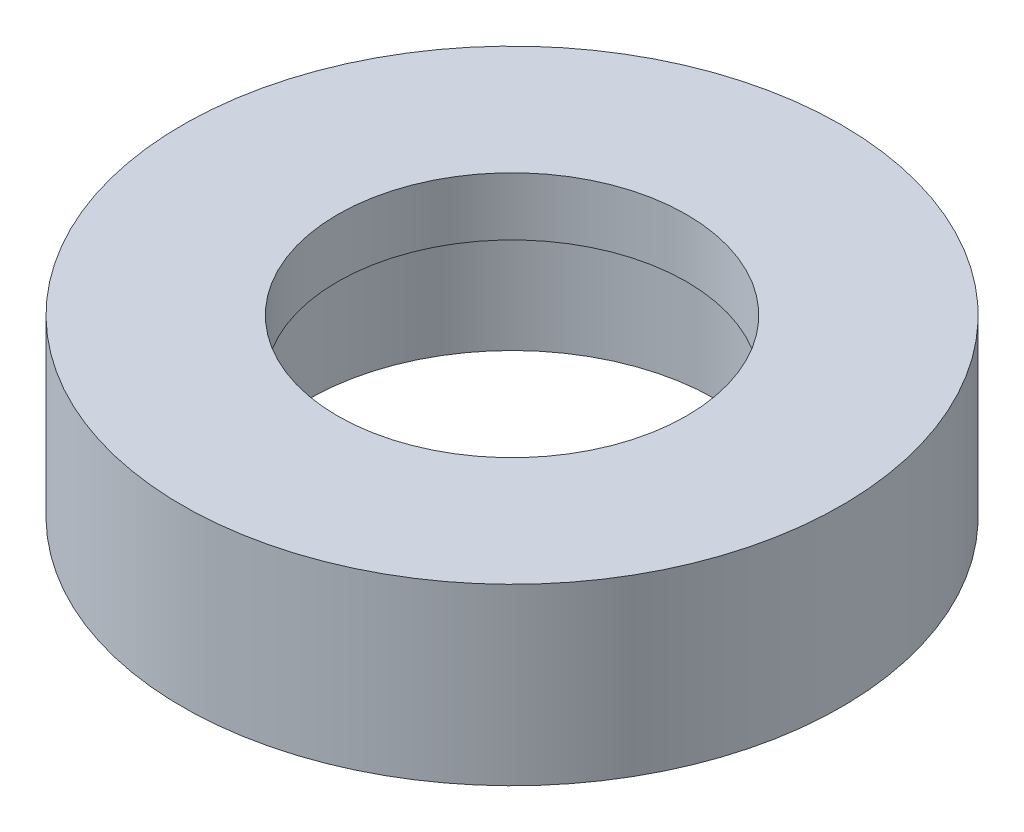
from build123d import *

# Parameters (mm, degrees)
CROQUIS4_R            = 3
CORTAR_EXTRUIR2_DEPTH = 10


with BuildPart() as part:
    # Croquis3 → Revolución1 (revolve)
    with BuildSketch(Plane.XY, mode=Mode.PRIVATE) as revoluci_n1_sk:
        Polygon((-18, 17.500583769), (-34, 17.500583769), (-34, -0.499416231), (-21, -0.499416231), (-21, 11.500583769), (-18, 11.500583769), align=None)
    revolve(revoluci_n1_sk.sketch.rotate(Axis((0, 0, 0), (0, 1, 0)), 270), axis=Axis((0, 0, 0), (0, 1, 0)))

    # Croquis4 → Cortar-Extruir2 (cut)
    with BuildSketch(Plane.XZ.offset(0.499416231)):
        with Locations(Location((0, 27.6, 0), (0, 0, 270))):
            Circle(CROQUIS4_R)
        with Locations(Location((27.6, 0, 0), (0, 0, 270))):
            Circle(CROQUIS4_R)
        with Locations(Location((0, -27.6, 0), (0, 0, 270))):
            Circle(CROQUIS4_R)
        with Locations(Location((-27.6, 0, 0), (0, 0, 270))):
            Circle(CROQUIS4_R)
    extrude(amount=-CORTAR_EXTRUIR2_DEPTH, mode=Mode.SUBTRACT)


solid = part.part
